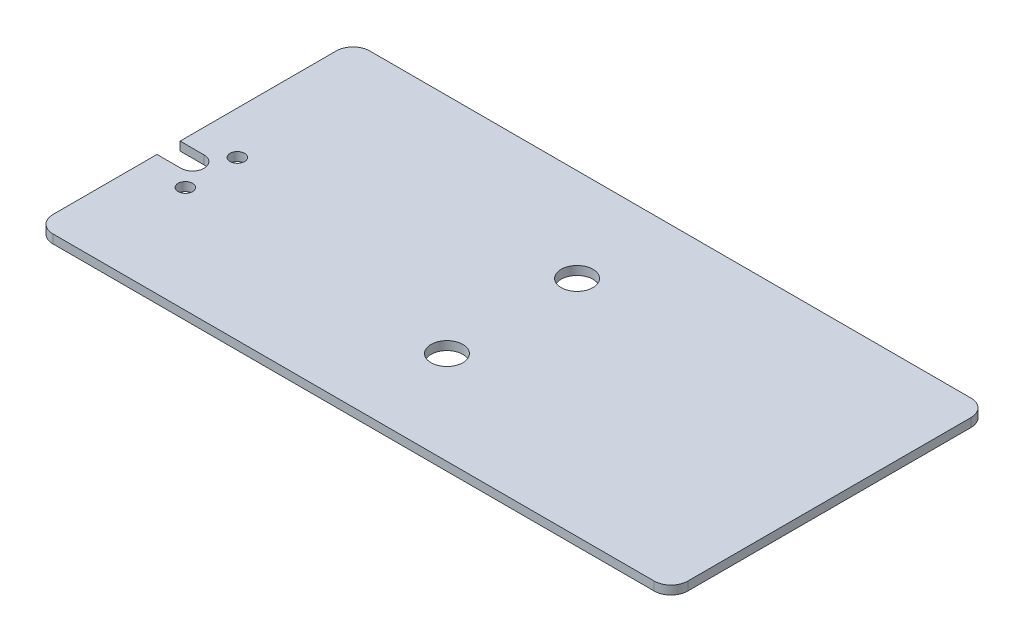
from build123d import *

# Parameters (mm, degrees)
SKETCH_1_W          = 220
SKETCH_1_H          = 110
EXTRUDE_1_DEPTH     = 3
SKETCH_2_W          = 220
SKETCH_2_H          = 110
CUT_EXTRUDE_1_DEPTH = 10
SKETCH_3_R          = 2.5
SKETCH_3_R_2        = 1.5875
CUT_EXTRUDE_2_DEPTH = 123.752107925
SKETCH_4_R          = 5.5
CUT_EXTRUDE_3_DEPTH = 123.752107925


with BuildPart() as part:
    # Эскиз1 → Бобышка-Вытянуть1 (new body)
    with BuildSketch(Plane(origin=(0, 0, 0), x_dir=(1, 0, 0), z_dir=(0, 1, 0))):
        Rectangle(SKETCH_1_W, SKETCH_1_H)
    extrude(amount=EXTRUDE_1_DEPTH)

    # Эскиз2 → Вырез-Вытянуть1 (cut)
    with BuildSketch(Plane.XZ):
        Rectangle(SKETCH_2_W, SKETCH_2_H)
        with BuildLine():
            ThreePointArc((104, -54.8), (108.101219331, -53.101219331), (109.8, -49))
            Line((109.8, -49), (109.8, 49))
            ThreePointArc((109.8, 49), (108.101219331, 53.101219331), (104, 54.8))
            Line((104, 54.8), (-104, 54.8))
            ThreePointArc((-104, 54.8), (-108.101219331, 53.101219331), (-109.8, 49))
            Line((-109.8, 49), (-109.8, -49))
            ThreePointArc((-109.8, -49), (-108.101219331, -53.101219331), (-104, -54.8))
            Line((-104, -54.8), (104, -54.8))
        make_face(mode=Mode.SUBTRACT)
    extrude(amount=-CUT_EXTRUDE_1_DEPTH, mode=Mode.SUBTRACT)

    # Эскиз3 → Вырез-Вытянуть2 (cut, through all)
    # profile 1 of 5: a face of its own
    with BuildSketch(Plane(origin=(0, 3, 0), x_dir=(1, 0, 0), z_dir=(0, 1, 0))):
        with Locations(Location((-95, 0, 0), (0, 0, 270))):
            Circle(SKETCH_3_R)
        with Locations((-95, 0)):
            Circle(SKETCH_3_R_2, mode=Mode.SUBTRACT)
    # profile 2 of 5: a face of its own
    with BuildSketch(Plane(origin=(0, 3, 0), x_dir=(1, 0, 0), z_dir=(0, 1, 0))):
        with Locations((-95, 0)):
            Circle(SKETCH_3_R_2)
    # profile 3 of 5: a face of its own
    with BuildSketch(Plane(origin=(0, 3, 0), x_dir=(1, 0, 0), z_dir=(0, 1, 0))):
        with Locations(Location((-95, -18, 0), (0, 0, 270))):
            Circle(SKETCH_3_R)
        with Locations((-95, -18)):
            Circle(SKETCH_3_R_2, mode=Mode.SUBTRACT)
    # profile 4 of 5: a face of its own
    with BuildSketch(Plane(origin=(0, 3, 0), x_dir=(1, 0, 0), z_dir=(0, 1, 0))):
        with Locations((-95, -18)):
            Circle(SKETCH_3_R_2)
    # profile 5 of 5: a face of its own
    with BuildSketch(Plane(origin=(0, 3, 0), x_dir=(1, 0, 0), z_dir=(0, 1, 0))):
        with BuildLine():
            ThreePointArc((-101.5, -13), (-97.5, -9), (-101.5, -5))
            Line((-101.5, -5), (-109.8, -5))
            Line((-109.8, -5), (-109.8, -13))
            Line((-109.8, -13), (-101.5, -13))
        make_face()
    extrude(amount=-CUT_EXTRUDE_2_DEPTH, mode=Mode.SUBTRACT)

    # Эскиз4 → Вырез-Вытянуть3 (cut, through all)
    with BuildSketch(Plane(origin=(0, 3, 0), x_dir=(1, 0, 0), z_dir=(0, 1, 0))):
        with Locations(Location((0, 22.5, 0), (0, 0, 270))):
            Circle(SKETCH_4_R)
        with Locations(Location((0, -22.5, 0), (0, 0, 270))):
            Circle(SKETCH_4_R)
    extrude(amount=-CUT_EXTRUDE_3_DEPTH, mode=Mode.SUBTRACT)


solid = part.part
